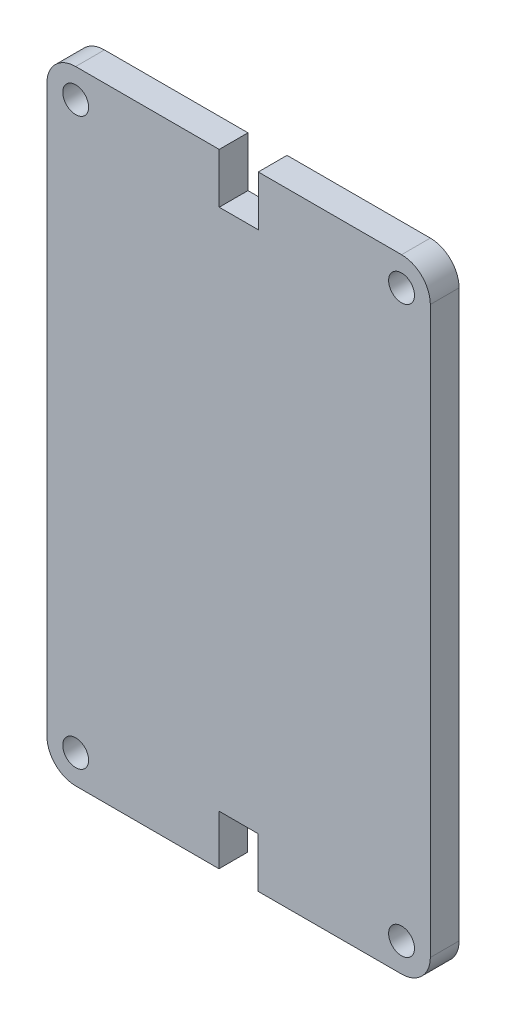
from build123d import *

# Parameters (mm, degrees)
BOSS_EXTRUDE1_DEPTH = 3
SKETCH2_R           = 1.35
CUT_EXTRUDE1_DEPTH  = 77.380625816


with BuildPart() as part:
    # Sketch1 → Boss-Extrude1 (new body)
    with BuildSketch(Plane.XY):
        with BuildLine():
            Line((3, 0), (17.95, -0.01))
            Line((17.95, -0.01), (17.95, 5.2))
            Line((17.95, 5.2), (22.025, 5.2))
            Line((22.025, 5.2), (22.025, -0.01))
            Line((22.025, -0.01), (37, 0))
            ThreePointArc((37, 0), (39.121320344, 0.878679656), (40, 3))
            Line((40, 3), (40, 62))
            ThreePointArc((40, 62), (39.121320344, 64.121320344), (37, 65))
            Line((37, 65), (22.05, 65))
            Line((22.05, 65), (22.05, 59.775))
            Line((22.05, 59.775), (17.975, 59.775))
            Line((17.975, 59.775), (17.975, 65))
            Line((17.975, 65), (3, 65))
            ThreePointArc((3, 65), (0.878679656, 64.121320344), (0, 62))
            Line((0, 62), (0, 3))
            ThreePointArc((0, 3), (0.878679656, 0.878679656), (3, 0))
        make_face()
    extrude(amount=BOSS_EXTRUDE1_DEPTH)

    # Sketch2 → Cut-Extrude1 (cut, through all)
    with BuildSketch(Plane.XY.offset(3)):
        with Locations((3, 3)):
            Circle(SKETCH2_R)
        with Locations((37, 3)):
            Circle(SKETCH2_R)
        with Locations((37, 62)):
            Circle(SKETCH2_R)
        with Locations((3, 62)):
            Circle(SKETCH2_R)
    extrude(amount=-CUT_EXTRUDE1_DEPTH, mode=Mode.SUBTRACT)


solid = part.part
